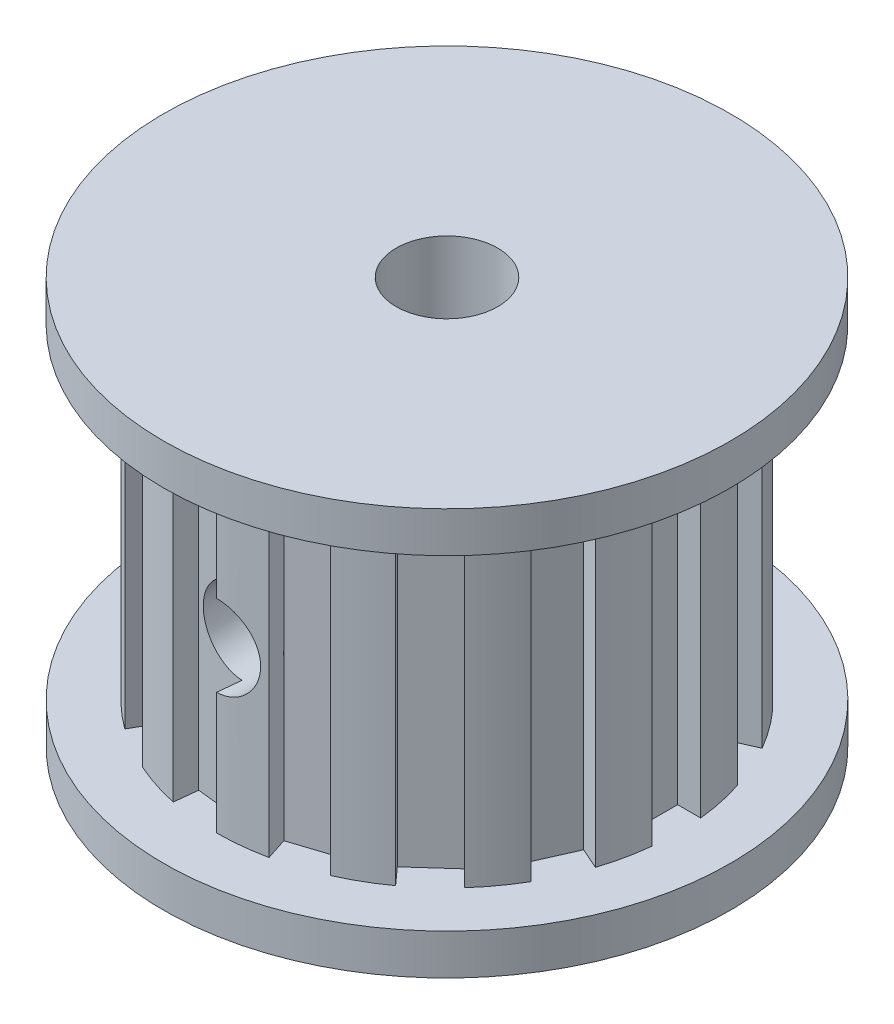
from build123d import *

# Parameters (mm, degrees)
SKETCH_1_R               = 11.35
EXTRUDE_1_DEPTH          = 8
SKETCH_2_R               = 13.95
EXTRUDE_2_DEPTH          = 2
EXTRUDE_START            = 2
SKETCH_3_R               = 13.95
EXTRUDE_3_DEPTH          = 2
SKETCH_4_R               = 2.5
CUT_EXTRUDE_1_DEPTH      = 29.09279267
SKETCH_5_R               = 2
CUT_EXTRUDE_2_DEPTH      = 23.117979112
SKETCH_6_W               = 2.4
SKETCH_6_H               = 16
CUT_EXTRUDE_3_DEPTH      = 1.2
PATTERN_CIRCULAR_1_COUNT = 15


with BuildPart() as part:
    # 草图1 → 凸台-拉伸1 (new, symmetric)
    with BuildSketch(Plane(origin=(0, 0, 0), x_dir=(1, 0, 0), z_dir=(0, 1, 0))):
        with Locations(Location((0, 0, 0), (0, 0, 270))):
            Circle(SKETCH_1_R)
    extrude(amount=EXTRUDE_1_DEPTH, both=True)

    # 草图2 → 凸台-拉伸2 (add)
    with BuildSketch(Plane(origin=(0, 8, 0), x_dir=(1, 0, 0), z_dir=(0, 1, 0))):
        with Locations(Location((0, 0, 0), (0, 0, 270))):
            Circle(SKETCH_2_R)
    extrude(amount=EXTRUDE_2_DEPTH)

    # 草图3 → 凸台-拉伸3 (add)
    with BuildSketch(Plane.XZ.offset(8).offset(EXTRUDE_START)):
        with Locations(Location((0, 0, 0), (0, 0, 90))):
            Circle(SKETCH_3_R)
    extrude(amount=-EXTRUDE_3_DEPTH)

    # 草图4 → 切除-拉伸1 (cut, through all)
    with BuildSketch(Plane(origin=(0, 10, 0), x_dir=(1, 0, 0), z_dir=(0, 1, 0))):
        with Locations(Location((0, 0, 0), (0, 0, 270))):
            Circle(SKETCH_4_R)
    extrude(amount=-CUT_EXTRUDE_1_DEPTH, mode=Mode.SUBTRACT)

    # 草图5 → 切除-拉伸2 (cut, through all)
    with BuildSketch(Plane.XY):
        with Locations(Location((0, 0, 0), (0, 0, 90.000000031))):
            Circle(SKETCH_5_R)
    extrude(amount=CUT_EXTRUDE_2_DEPTH, mode=Mode.SUBTRACT)

    # 草图6 → 切除-拉伸3 (cut, symmetric)
    with BuildSketch(Plane.XY):
        with Locations((11.35, 0)):
            Rectangle(SKETCH_6_W, SKETCH_6_H)
    cut_extrude_3 = extrude(amount=CUT_EXTRUDE_3_DEPTH, both=True, mode=Mode.SUBTRACT)

    # 阵列(圆周)1: 切除-拉伸3 ×15 about axis
    pattern_circular_1_axis = Axis((0, 0, 0), (0, 1, 0))
    for i in range(1, PATTERN_CIRCULAR_1_COUNT):
        add(cut_extrude_3.rotate(pattern_circular_1_axis, i * 360 / PATTERN_CIRCULAR_1_COUNT), mode=Mode.SUBTRACT)


solid = part.part
